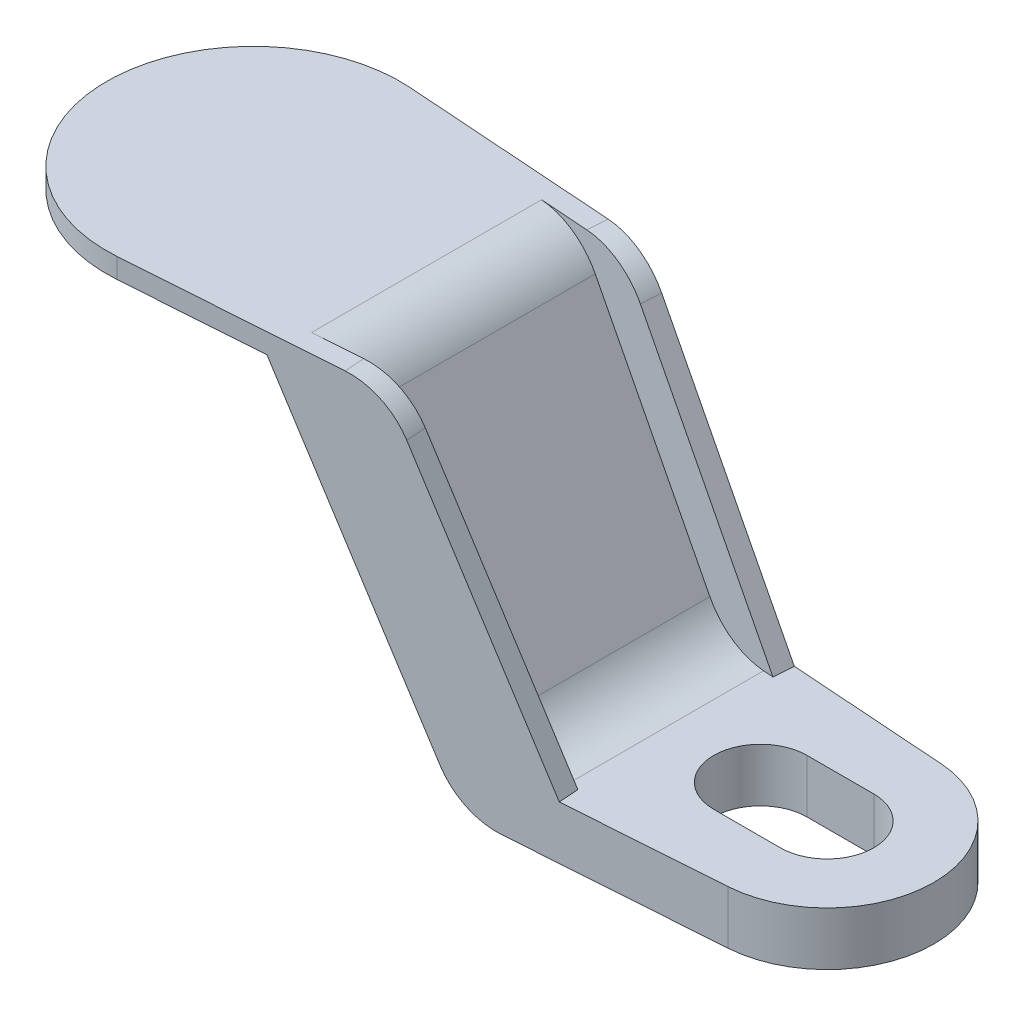
from build123d import *

# Parameters (mm, degrees)
BOSS_EXTRU_1_DEPTH           = 25
ENL_V_MAT_EXTRU_2_DEPTH      = 58.853262656
ENL_V_MAT_EXTRU_2_DEPTH_BACK = 58.853262656
BOSS_EXTRU_2_DEPTH           = 1.5
CONG_1_R                     = 5


with BuildPart() as part:
    # Esquisse1 → Boss.-Extru.1 (new body)
    with BuildSketch(Plane(origin=(0, 0, 0), x_dir=(1, 0, 0), z_dir=(0, 1, 0))):
        with BuildLine():
            Line((0.76744186, 10.973196116), (43.558139535, 7.980506266))
            ThreePointArc((43.558139535, 7.980506266), (51, 0), (43.558139535, -7.980506266))
            Line((43.558139535, -7.980506266), (0.76744186, -10.973196116))
            ThreePointArc((0.76744186, -10.973196116), (-11, 0), (0.76744186, 10.973196116))
        make_face()
        with BuildLine():
            Line((43, -3.5), (38, -3.5))
            ThreePointArc((38, -3.5), (34.5, 0), (38, 3.5))
            Line((38, 3.5), (43, 3.5))
            ThreePointArc((43, 3.5), (46.5, 0), (43, -3.5))
        make_face(mode=Mode.SUBTRACT)
    extrude(amount=BOSS_EXTRU_1_DEPTH)

    # Esquisse4 → Enlèv. mat.-Extru.2 (cut, two sides: drawn at the far end of the back side and taken through both)
    with BuildSketch(Plane.XY.offset(-ENL_V_MAT_EXTRU_2_DEPTH_BACK)):
        Polygon((-11, 0), (28.567731326, 0), (15, 23.5), (-11, 23.5), align=None)
        Polygon((51, 25), (15.866025404, 25), (27.990381057, 4), (51, 4), align=None)
    extrude(amount=ENL_V_MAT_EXTRU_2_DEPTH + ENL_V_MAT_EXTRU_2_DEPTH_BACK, mode=Mode.SUBTRACT)

    # Esquisse6 → Boss.-Extru.2 (add)
    with BuildSketch(Plane(origin=(0.76744186, 0, 10.973196116), x_dir=(0.997563283233824, 0, -0.0697674418604651), z_dir=(0.0697674418604651, 0, 0.9975632832338241))):
        Polygon((9.645698279, 25), (18.888948853, 25), (33.357962471, 0), (24.114711897, 0), align=None)
    boss_extru_2 = extrude(amount=-BOSS_EXTRU_2_DEPTH)

    # Symétrie1: Boss.-Extru.2 across plane
    add(boss_extru_2.mirror(Plane.XY))

    # Congé1
    cong_1_edges = [part.edges().sort_by_distance(p)[0] for p in [
        (27.990381057, 4, 0),
        (15, 23.5, 0),
        (28.567731326, 0, 0),
        (15.866025404, 25, 0),
        (24.771067454, 0, -8.542601893),
        (19.558038113, 25, -8.907190012),
        (24.771067454, 0, 8.542601893),
        (19.558038113, 25, 8.907190012),
    ]]
    fillet(cong_1_edges, radius=CONG_1_R)


solid = part.part
